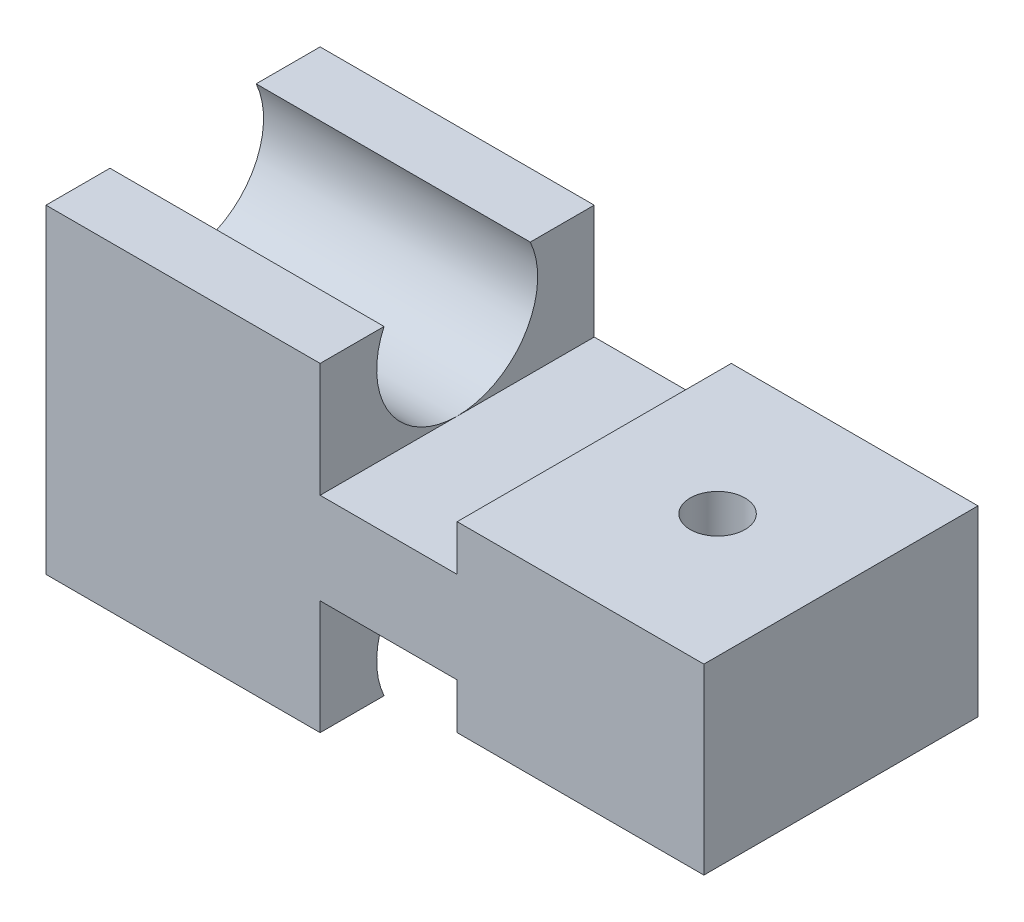
from build123d import *

# Parameters (mm, degrees)
SKETCH1_W           = 30
SKETCH1_H           = 35
SKETCH1_W_2         = 27
SKETCH1_H_2         = 20
SKETCH1_W_3         = 15
SKETCH1_H_3         = 10
BOSS_EXTRUDE1_DEPTH = 30
CUT_EXTRUDE1_DEPTH  = 8
SKETCH15_R          = 3
CUT_EXTRUDE3_DEPTH  = 71.037489961
CUT_EXTRUDE6_DEPTH  = 30


with BuildPart() as part:
    # Sketch1 → Boss-Extrude1 (new body)
    with BuildSketch(Plane.XY):
        Rectangle(SKETCH1_W, SKETCH1_H)
        with Locations((43.5, 0)):
            Rectangle(SKETCH1_W_2, SKETCH1_H_2)
        with Locations((22.5, 0)):
            Rectangle(SKETCH1_W_3, SKETCH1_H_3)
    extrude(amount=BOSS_EXTRUDE1_DEPTH)

    # Sketch1<3> → Cut-Extrude1 (cut)
    with BuildSketch(Plane.XY):
        with BuildLine():
            ThreePointArc((15, 1.5), (13.5, 0), (15, -1.5))
            Line((15, -1.5), (15, 1.5))
        make_face()
        with BuildLine():
            Line((15, 1.5), (15, -1.5))
            ThreePointArc((15, -1.5), (16.060660172, -1.060660172), (16.5, 0))
            ThreePointArc((16.5, 0), (16.060660172, 1.060660172), (15, 1.5))
        make_face()
    extrude(amount=CUT_EXTRUDE1_DEPTH, mode=Mode.SUBTRACT)

    # Sketch15 → Cut-Extrude3 (cut, through all)
    with BuildSketch(Plane(origin=(0, 10, 0), x_dir=(1, 0, 0), z_dir=(0, 1, 0))):
        with Locations(Location((43.5, -15, 0), (0, 0, 270))):
            Circle(SKETCH15_R)
    extrude(amount=-CUT_EXTRUDE3_DEPTH, mode=Mode.SUBTRACT)

    # Sketch5 → Cut-Extrude6 (cut)
    with BuildSketch(Plane.ZY.offset(15)):
        with BuildLine():
            Line((7, -17.5), (23, -17.5))
            ThreePointArc((23, -17.5), (15, -5), (7, -17.5))
        make_face()
        with BuildLine():
            Line((7, 17.5), (23, 17.5))
            ThreePointArc((23, 17.5), (15, 5), (7, 17.5))
        make_face()
    extrude(amount=-CUT_EXTRUDE6_DEPTH, mode=Mode.SUBTRACT)


solid = part.part
